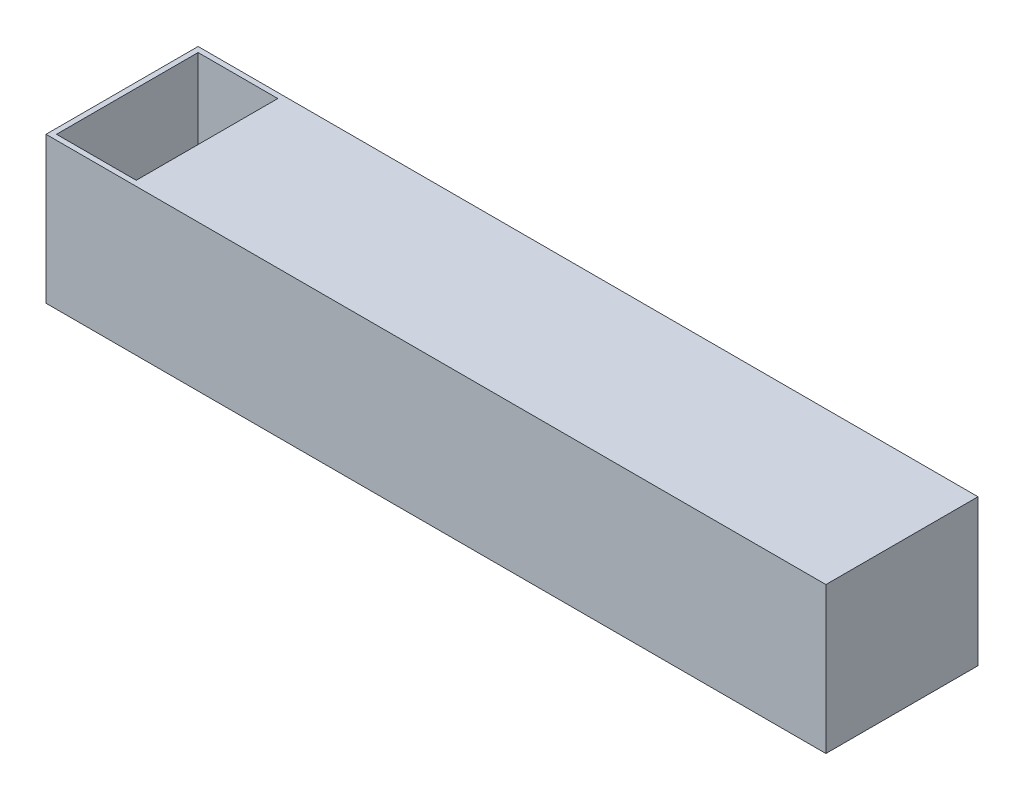
from build123d import *

# Parameters (mm, degrees)
ESQUISSE1_W             = 743.48850074
ESQUISSE1_H             = 139.522790213
BOSS_EXTRU_1_DEPTH      = 135
ESQUISSE1_4_W           = 743.48850074
ESQUISSE1_4_H           = 139.522790213
BOSS_EXTRU_3_DEPTH      = 5
ESQUISSE2_W             = 743.48850074
ESQUISSE2_H             = 139.522790213
BOSS_EXTRU_4_DEPTH      = 5
ESQUISSE3_W             = 76
ESQUISSE3_H             = 135
ENL_V_MAT_EXTRU_1_DEPTH = 10
ESQUISSE4_W             = 76
ESQUISSE4_H             = 135
ENL_V_MAT_EXTRU_2_DEPTH = 10


with BuildPart() as part:
    # Esquisse1 → Boss.-Extru.1 (new body)
    with BuildSketch(Plane.XY):
        with Locations((335.166692979, 135.809178026)):
            Rectangle(ESQUISSE1_W, ESQUISSE1_H)
        Polygon((625.910943349, 69.047782919), (-31.577557391, 126.570573132), (-31.577557391, 202.570573132), (701.910943349, 202.570573132), (701.910943349, 69.047782919), align=None, mode=Mode.SUBTRACT)
        Polygon((-31.577557391, 121.551473945), (568.542377121, 69.047782919), (-31.577557391, 69.047782919), align=None, mode=Mode.SUBTRACT)
    extrude(amount=BOSS_EXTRU_1_DEPTH)

    # Esquisse1<4> → Boss.-Extru.3 (add)
    with BuildSketch(Plane.XY):
        with Locations((335.166692979, 135.809178026)):
            Rectangle(ESQUISSE1_4_W, ESQUISSE1_4_H)
    extrude(amount=-BOSS_EXTRU_3_DEPTH)

    # Esquisse2 → Boss.-Extru.4 (add)
    with BuildSketch(Plane.XY.offset(135)):
        with Locations((335.166692979, 135.809178026)):
            Rectangle(ESQUISSE2_W, ESQUISSE2_H)
    extrude(amount=BOSS_EXTRU_4_DEPTH)

    # Esquisse3 → Enlèv. mat.-Extru.1 (cut)
    with BuildSketch(Plane(origin=(0, 205.570573132, 0), x_dir=(1, 0, 0), z_dir=(0, 1, 0))):
        with Locations((6.422442609, -67.5)):
            Rectangle(ESQUISSE3_W, ESQUISSE3_H)
    extrude(amount=-ENL_V_MAT_EXTRU_1_DEPTH, mode=Mode.SUBTRACT)

    # Esquisse4 → Enlèv. mat.-Extru.2 (cut)
    with BuildSketch(Plane.XZ.offset(-66.047782919)):
        with Locations((663.910943349, 67.5)):
            Rectangle(ESQUISSE4_W, ESQUISSE4_H)
    extrude(amount=-ENL_V_MAT_EXTRU_2_DEPTH, mode=Mode.SUBTRACT)


solid = part.part
